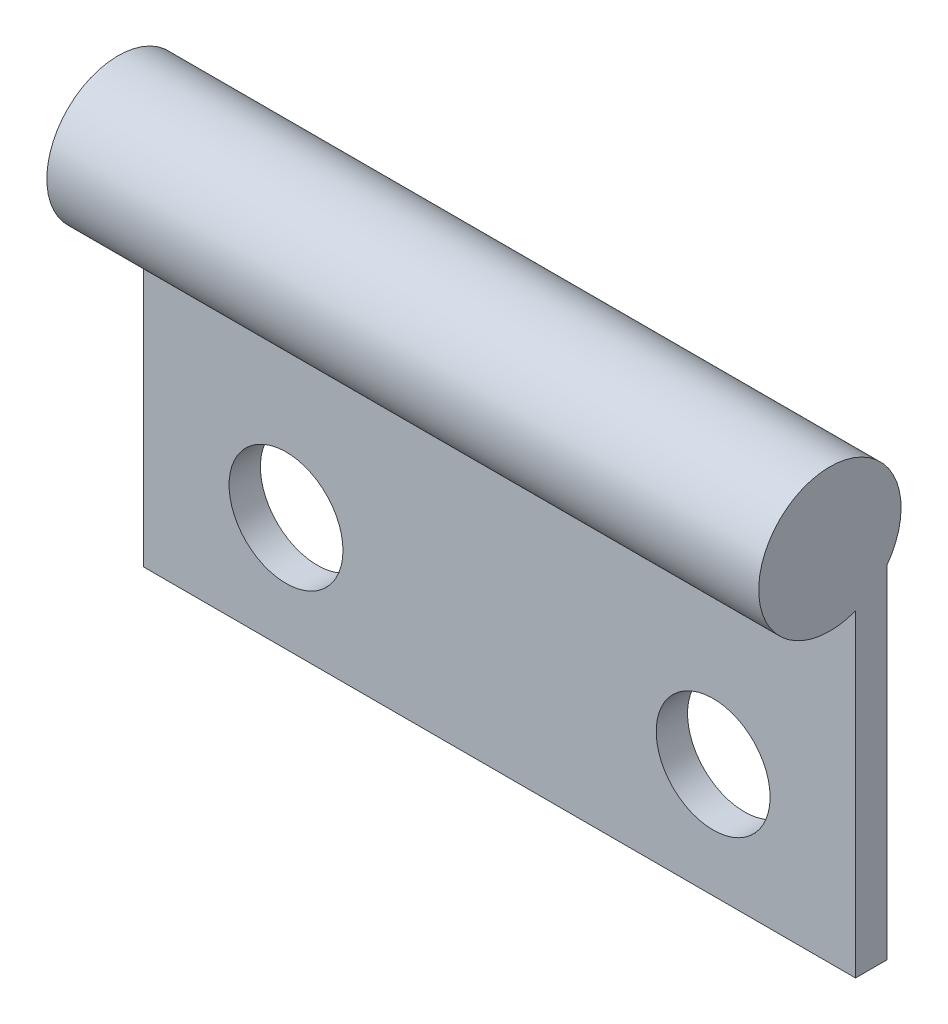
from build123d import *

# Parameters (mm, degrees)
SKETCH_1_W      = 25
SKETCH_1_H      = 13.5
SKETCH_1_R      = 2
EXTRUDE_1_DEPTH = 1.1
SKETCH_2_R      = 2.5
EXTRUDE_2_DEPTH = 25


with BuildPart() as part:
    # 草图1 → 凸台-拉伸1 (new body)
    with BuildSketch(Plane.XY):
        with Locations((12.5, 6.75)):
            Rectangle(SKETCH_1_W, SKETCH_1_H)
        with Locations((5, 4)):
            Circle(SKETCH_1_R, mode=Mode.SUBTRACT)
        with Locations((20, 4)):
            Circle(SKETCH_1_R, mode=Mode.SUBTRACT)
    extrude(amount=EXTRUDE_1_DEPTH)

    # 草图2 → 凸台-拉伸2 (add)
    with BuildSketch(Plane.ZY):
        with Locations((2, 13.5)):
            Circle(SKETCH_2_R)
    extrude(amount=-EXTRUDE_2_DEPTH)


solid = part.part
